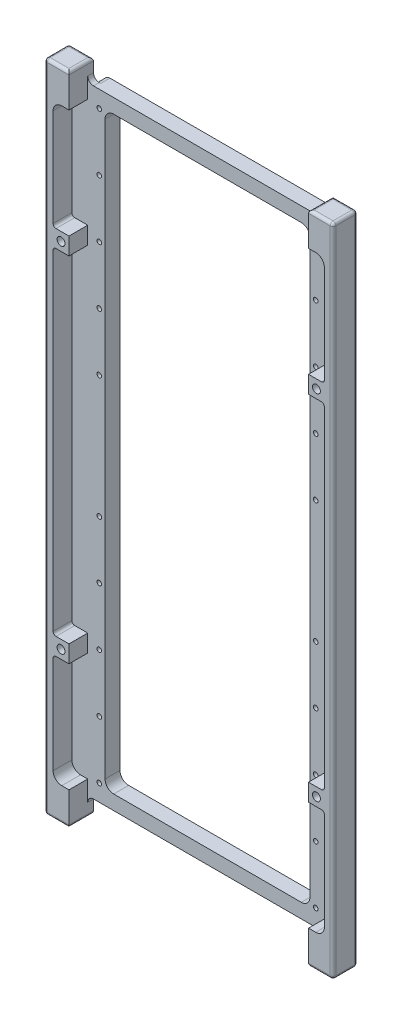
from build123d import *

# Parameters (mm, degrees)
SKETCH1_W             = 8.5
SKETCH1_H             = 8.5
BOSS_EXTRUDE1_DEPTH   = 227
SKETCH2_W             = 2
SKETCH2_H             = 214
BOSS_EXTRUDE2_DEPTH   = 50
BOSS_EXTRUDE3_DEPTH   = 3.18
CUT_EXTRUDE1_DEPTH    = 233.734660934
FILLET1_R             = 2
FILLET2_R             = 1
CUT_EXTRUDE2_DEPTH    = 6.5
M2X0_4_TAPPED_HOLE1_D = 1.6
SKETCH8_R             = 1.375
CUT_EXTRUDE3_DEPTH    = 233.596754062
SKETCH9_R             = 2.5
CUT_EXTRUDE4_DEPTH    = 4.75
LPATTERN1_COUNT       = 2
LPATTERN1_PITCH       = 88.5
LPATTERN1_COUNT_DIR2  = 2
LPATTERN1_PITCH_DIR2  = 122.4


with BuildPart() as part:
    # Sketch1 → Boss-Extrude1 (new body)
    with BuildSketch(Plane(origin=(0, 0, 0), x_dir=(1, 0, 0), z_dir=(0, 1, 0))):
        with Locations((45.75, 0)):
            Rectangle(SKETCH1_W, SKETCH1_H)
    boss_extrude1 = extrude(amount=BOSS_EXTRUDE1_DEPTH)

    # Sketch2 → Boss-Extrude2 (add)
    with BuildSketch(Plane.ZY.offset(-41.5)):
        with Locations((-3.25, 113.5)):
            Rectangle(SKETCH2_W, SKETCH2_H)
    boss_extrude2 = extrude(amount=BOSS_EXTRUDE2_DEPTH)

    # Mirror2: Boss-Extrude1, Boss-Extrude2 across plane
    add(boss_extrude1.mirror(Plane(origin=(0, 0, 0), x_dir=(0, 0, 1), z_dir=(1, 0, 0))))
    add(boss_extrude2.mirror(Plane(origin=(0, 0, 0), x_dir=(0, 0, 1), z_dir=(1, 0, 0))))

    # Sketch3 → Boss-Extrude3 (add)
    with BuildSketch(Plane(origin=(0, 0, -4.25), x_dir=(-1, 0, 0), z_dir=(0, 0, -1))):
        with BuildLine():
            Line((-39, 6.5), (39, 6.5))
            ThreePointArc((39, 6.5), (40.414213562, 7.085786438), (41, 8.5))
            Line((41, 8.5), (41, 218.5))
            ThreePointArc((41, 218.5), (40.414213562, 219.914213562), (39, 220.5))
            Line((39, 220.5), (-39, 220.5))
            ThreePointArc((-39, 220.5), (-40.414213562, 219.914213562), (-41, 218.5))
            Line((-41, 218.5), (-41, 8.5))
            ThreePointArc((-41, 8.5), (-40.414213562, 7.085786438), (-39, 6.5))
        make_face()
    extrude(amount=BOSS_EXTRUDE3_DEPTH)

    # Sketch4 → Cut-Extrude1 (cut, through all)
    with BuildSketch(Plane(origin=(0, 0, -7.43), x_dir=(-1, 0, 0), z_dir=(0, 0, -1))):
        with BuildLine():
            Line((-32.5, 11.5), (32.5, 11.5))
            ThreePointArc((32.5, 11.5), (34.621320344, 12.378679656), (35.5, 14.5))
            Line((35.5, 14.5), (35.5, 212.5))
            ThreePointArc((35.5, 212.5), (34.621320344, 214.621320344), (32.5, 215.5))
            Line((32.5, 215.5), (-32.5, 215.5))
            ThreePointArc((-32.5, 215.5), (-34.621320344, 214.621320344), (-35.5, 212.5))
            Line((-35.5, 212.5), (-35.5, 14.5))
            ThreePointArc((-35.5, 14.5), (-34.621320344, 12.378679656), (-32.5, 11.5))
        make_face()
    extrude(amount=-CUT_EXTRUDE1_DEPTH, mode=Mode.SUBTRACT)

    # Fillet1
    fillet1_edges = [part.edges().sort_by_distance(p)[0] for p in [
        (41.5, 6.5, -3.25),
        (-41.5, 6.5, -3.25),
        (41.5, 220.5, -3.25),
        (-41.5, 220.5, -3.25),
    ]]
    fillet(fillet1_edges, radius=FILLET1_R)

    # Fillet2
    fillet2_edges = [part.edges().sort_by_distance(p)[0] for p in [
        (41.5, 227, 0),
        (45.75, 227, 4.25),
        (-41.5, 227, 0),
        (-50, 227, 0),
        (-50, 113.5, -4.25),
        (-45.75, 227, -4.25),
        (-45.75, 227, 4.25),
        (-50, 113.5, 4.25),
        (-50, 0, 0),
        (-45.75, 0, -4.25),
        (-41.5, 0, 0),
        (-45.75, 0, 4.25),
        (50, 227, 0),
        (45.75, 0, 4.25),
        (41.5, 0, 0),
        (45.75, 0, -4.25),
        (50, 0, 0),
        (45.75, 227, -4.25),
        (50, 113.5, 4.25),
        (50, 113.5, -4.25),
    ]]
    fillet(fillet2_edges, radius=FILLET2_R)

    # Sketch5 → Cut-Extrude2 (cut)
    with BuildSketch(Plane.XY.offset(4.25)):
        with BuildLine():
            Line((-44, 11.5), (44, 11.5))
            ThreePointArc((44, 11.5), (46.121320344, 12.378679656), (47, 14.5))
            Line((47, 14.5), (47, 48.3))
            ThreePointArc((47, 48.3), (46.707106781, 49.007106781), (46, 49.3))
            Line((46, 49.3), (41.5, 49.3))
            Line((41.5, 49.3), (41.5, 55.3))
            Line((41.5, 55.3), (46, 55.3))
            ThreePointArc((46, 55.3), (46.707106781, 55.592893219), (47, 56.3))
            Line((47, 56.3), (47, 170.7))
            ThreePointArc((47, 170.7), (46.707106781, 171.407106781), (46, 171.7))
            Line((46, 171.7), (41.5, 171.7))
            Line((41.5, 171.7), (41.5, 177.7))
            Line((41.5, 177.7), (46, 177.7))
            ThreePointArc((46, 177.7), (46.707106781, 177.992893219), (47, 178.7))
            Line((47, 178.7), (47, 212.5))
            ThreePointArc((47, 212.5), (46.121320344, 214.621320344), (44, 215.5))
            Line((44, 215.5), (-44, 215.5))
            ThreePointArc((-44, 215.5), (-46.121320344, 214.621320344), (-47, 212.5))
            Line((-47, 212.5), (-47, 178.7))
            ThreePointArc((-47, 178.7), (-46.707106781, 177.992893219), (-46, 177.7))
            Line((-46, 177.7), (-41.5, 177.7))
            Line((-41.5, 177.7), (-41.5, 171.7))
            Line((-41.5, 171.7), (-46, 171.7))
            ThreePointArc((-46, 171.7), (-46.707106781, 171.407106781), (-47, 170.7))
            Line((-47, 170.7), (-47, 56.3))
            ThreePointArc((-47, 56.3), (-46.707106781, 55.592893219), (-46, 55.3))
            Line((-46, 55.3), (-41.5, 55.3))
            Line((-41.5, 55.3), (-41.5, 49.3))
            Line((-41.5, 49.3), (-46, 49.3))
            ThreePointArc((-46, 49.3), (-46.707106781, 49.007106781), (-47, 48.3))
            Line((-47, 48.3), (-47, 14.5))
            ThreePointArc((-47, 14.5), (-46.121320344, 12.378679656), (-44, 11.5))
        make_face()
    extrude(amount=-CUT_EXTRUDE2_DEPTH, mode=Mode.SUBTRACT)

    # M2x0.4 Tapped Hole1 (through all)
    with Locations(Plane(origin=(0, 0, -7.43), x_dir=(-1, 0, 0), z_dir=(0, 0, -1))):
        with Locations((-37.5, 214.7), (37.5, 214.7), (37.5, 194.7), (37.5, 174.7), (37.5, 154.7), (37.5, 134.7), (-37.5, 194.7), (-37.5, 174.7), (-37.5, 154.7), (-37.5, 134.7), (-37.5, 12.3), (-37.5, 32.3), (-37.5, 52.3), (-37.5, 72.3), (-37.5, 92.3), (37.5, 92.3), (37.5, 72.3), (37.5, 52.3), (37.5, 32.3), (37.5, 12.3)):
            Hole(M2X0_4_TAPPED_HOLE1_D / 2)

    # Sketch8 → Cut-Extrude3 (cut, through all)
    with BuildSketch(Plane(origin=(0, 0, -4.25), x_dir=(-1, 0, 0), z_dir=(0, 0, -1))):
        with Locations((-44.25, 174.7)):
            Circle(SKETCH8_R)
    cut_extrude3 = extrude(amount=-CUT_EXTRUDE3_DEPTH, mode=Mode.SUBTRACT)

    # Sketch9 → Cut-Extrude4 (cut)
    with BuildSketch(Plane(origin=(0, 0, -4.25), x_dir=(-1, 0, 0), z_dir=(0, 0, -1))):
        with Locations((-44.25, 174.7)):
            Circle(SKETCH9_R)
    cut_extrude4 = extrude(amount=-CUT_EXTRUDE4_DEPTH, mode=Mode.SUBTRACT)

    # LPattern1: Cut-Extrude3, Cut-Extrude4 2 × 2
    with Locations(*[(-i * LPATTERN1_PITCH, -j * LPATTERN1_PITCH_DIR2, 0) for i in range(LPATTERN1_COUNT) for j in range(LPATTERN1_COUNT_DIR2) if (i, j) != (0, 0)]):
        add(cut_extrude3, mode=Mode.SUBTRACT)
        add(cut_extrude4, mode=Mode.SUBTRACT)


solid = part.part
